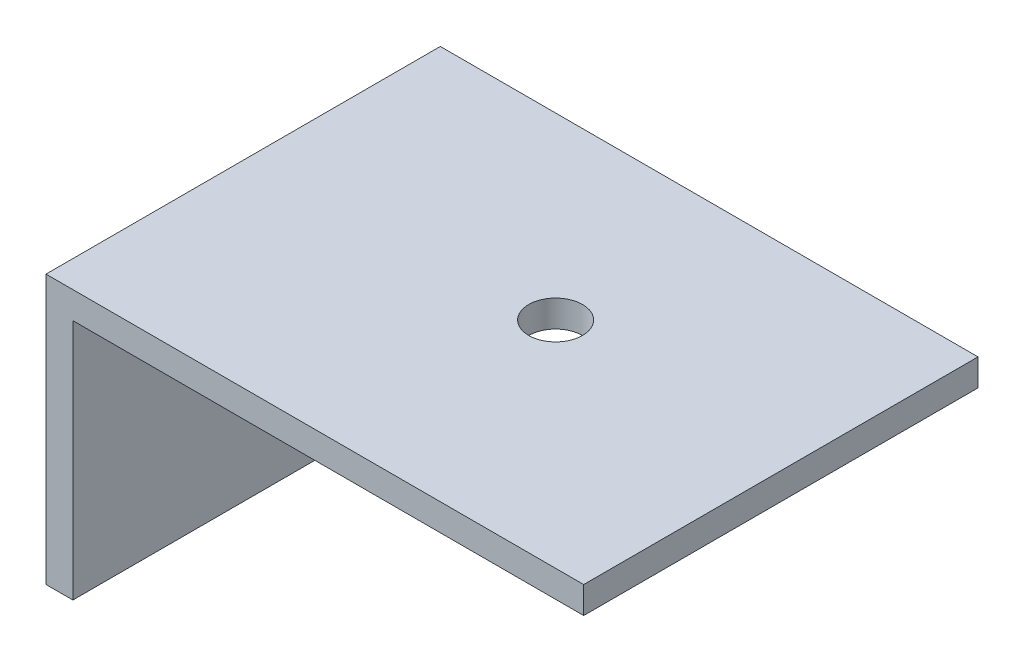
from build123d import *

# Parameters (mm, degrees)
SKETCH1_W           = 28.5
SKETCH1_H           = 22
SKETCH1_R           = 1.5
BOSS_EXTRUDE1_DEPTH = 1.5
SKETCH1_3_W         = 1.5
SKETCH1_3_H         = 22
BOSS_EXTRUDE2_DEPTH = 15


with BuildPart() as part:
    # Sketch1 → Boss-Extrude1 (new body)
    with BuildSketch(Plane(origin=(0, 0, 0), x_dir=(1, 0, 0), z_dir=(0, 1, 0))):
        with Locations((0.75, 0)):
            Rectangle(SKETCH1_W, SKETCH1_H)
        with Locations((1.435, 1)):
            Circle(SKETCH1_R, mode=Mode.SUBTRACT)
    extrude(amount=-BOSS_EXTRUDE1_DEPTH)

    # Sketch1<3> → Boss-Extrude2 (add)
    with BuildSketch(Plane(origin=(0, 0, 0), x_dir=(1, 0, 0), z_dir=(0, 1, 0))):
        with Locations((-14.25, 0)):
            Rectangle(SKETCH1_3_W, SKETCH1_3_H)
    extrude(amount=-BOSS_EXTRUDE2_DEPTH)


solid = part.part
